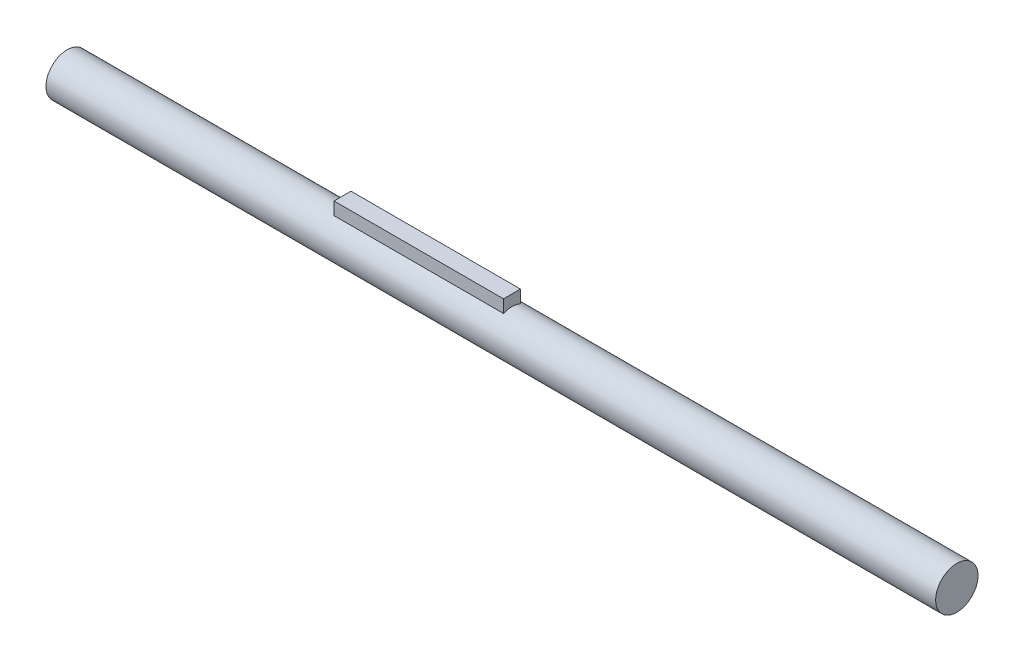
from build123d import *

# Parameters (mm, degrees)
SKETCH1_R           = 25
BOSS_EXTRUDE1_DEPTH = 1050
SKETCH2_W           = 20
SKETCH2_H           = 15
BOSS_EXTRUDE2_DEPTH = 200


with BuildPart() as part:
    # Sketch1 → Boss-Extrude1 (new body)
    with BuildSketch(Plane(origin=(0, 0, 0), x_dir=(0, 0, -1), z_dir=(1, 0, 0))):
        Circle(SKETCH1_R)
    extrude(amount=BOSS_EXTRUDE1_DEPTH)

    # Sketch2 → Boss-Extrude2 (add)
    with BuildSketch(Plane.ZY.offset(-325)):
        with Locations((0, 30.412878475)):
            Rectangle(SKETCH2_W, SKETCH2_H)
    extrude(amount=-BOSS_EXTRUDE2_DEPTH)


solid = part.part
